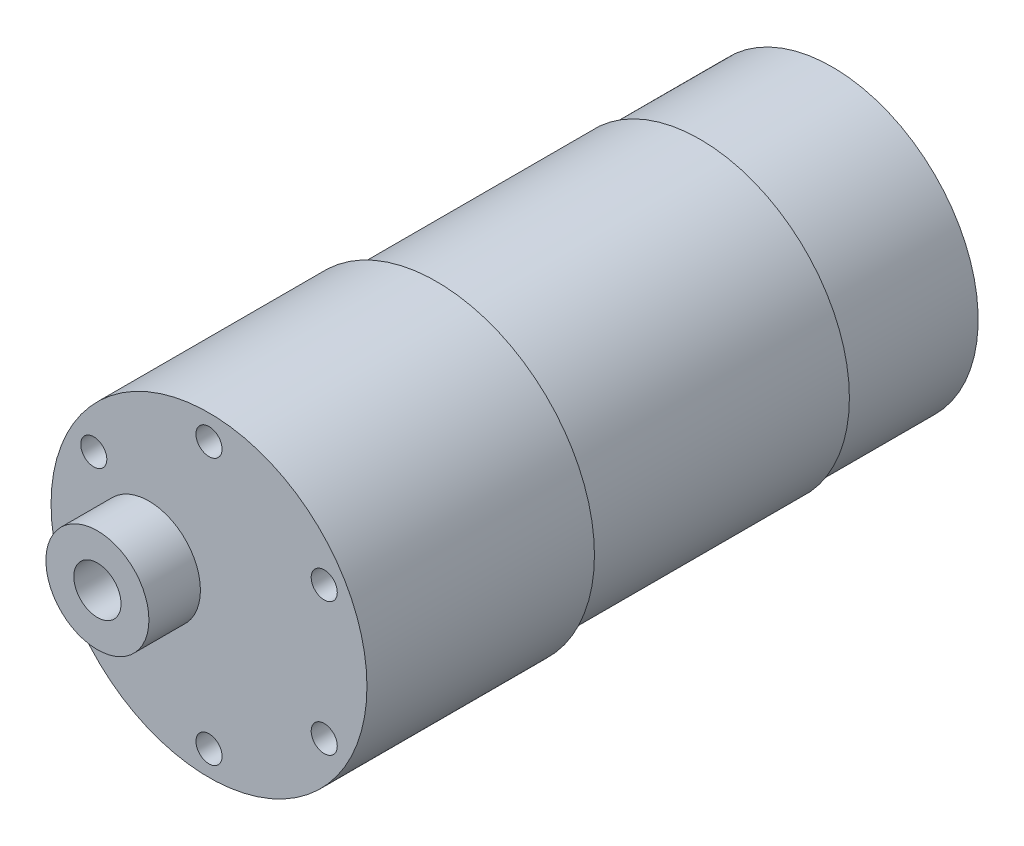
from build123d import *

# Parameters (mm, degrees)
F_01_START                                  = -57.2
S01_POLOLU_4755_BRUSHED_MOTOR_CAN_R         = 17.4
F_01_POLOLU_4755_BRUSHED_MOTOR_CAN_DEPTH    = 30.7
F_02_START                                  = -26.5
S02_37D_GEARBOX_BODY_R                      = 18.4
F_02_37D_GEARBOX_BODY_DEPTH                 = 26.5
F_03_START                                  = -3
S03_MANUFACTURER_SIX_M3_FACE_THREADS_R      = 1.52
F_03_MANUFACTURER_SIX_M3_FACE_THREADS_DEPTH = 3.2
S04_FRONT_LOCATING_BOSS_R                   = 6
F_04_FRONT_LOCATING_BOSS_DEPTH              = 6
F_05_START                                  = -72.6
S05_QUADRATURE_ENCODER_REAR_CAP_15_4_R      = 17
F_05_QUADRATURE_ENCODER_REAR_CAP_15_4_DEPTH = 15.4
F_06_START                                  = 1.6
S06_SHAFT_JOURNAL_AT_GEARBOX_OUTPUT_R       = 2.75
F_06_SHAFT_JOURNAL_AT_GEARBOX_OUTPUT_DEPTH  = 4.5


with BuildPart() as part:
    # S01 - Pololu 4755 brushed motor can → 01 - Pololu 4755 brushed motor can (new body)
    with BuildSketch(Plane.XY.offset(F_01_START)):
        with Locations((7, 0)):
            Circle(S01_POLOLU_4755_BRUSHED_MOTOR_CAN_R)
    extrude(amount=F_01_POLOLU_4755_BRUSHED_MOTOR_CAN_DEPTH)

    # S02 - 37D gearbox body → 02 - 37D gearbox body (add)
    with BuildSketch(Plane.XY.offset(F_02_START)):
        with Locations((7, 0)):
            Circle(S02_37D_GEARBOX_BODY_R)
    extrude(amount=F_02_37D_GEARBOX_BODY_DEPTH)

    # S03 - Manufacturer six M3 face threads → 03 - Manufacturer six M3 face threads (cut)
    with BuildSketch(Plane.XY.offset(F_03_START)):
        with Locations((20.423393759, 7.75)):
            Circle(S03_MANUFACTURER_SIX_M3_FACE_THREADS_R)
        with Locations((7, 15.5)):
            Circle(S03_MANUFACTURER_SIX_M3_FACE_THREADS_R)
        with Locations((-6.423393759, 7.75)):
            Circle(S03_MANUFACTURER_SIX_M3_FACE_THREADS_R)
        with Locations((-6.423393759, -7.75)):
            Circle(S03_MANUFACTURER_SIX_M3_FACE_THREADS_R)
        with Locations((7, -15.5)):
            Circle(S03_MANUFACTURER_SIX_M3_FACE_THREADS_R)
        with Locations((20.423393759, -7.75)):
            Circle(S03_MANUFACTURER_SIX_M3_FACE_THREADS_R)
    extrude(amount=F_03_MANUFACTURER_SIX_M3_FACE_THREADS_DEPTH, mode=Mode.SUBTRACT)

    # S04 - Front locating boss → 04 - Front locating boss (add)
    with BuildSketch(Plane.XY):
        Circle(S04_FRONT_LOCATING_BOSS_R)
    extrude(amount=F_04_FRONT_LOCATING_BOSS_DEPTH)

    # S05 - Quadrature encoder rear cap - 15.4 mm → 05 - Quadrature encoder rear cap - 15.4 mm (add)
    with BuildSketch(Plane.XY.offset(F_05_START)):
        with Locations(Location((7, 0, 0), (0, 0, 180))):
            Circle(S05_QUADRATURE_ENCODER_REAR_CAP_15_4_R)
    extrude(amount=F_05_QUADRATURE_ENCODER_REAR_CAP_15_4_DEPTH)

    # S06 - Shaft journal at gearbox output → 06 - Shaft journal at gearbox output (cut)
    with BuildSketch(Plane.XY.offset(F_06_START)):
        Circle(S06_SHAFT_JOURNAL_AT_GEARBOX_OUTPUT_R)
    extrude(amount=F_06_SHAFT_JOURNAL_AT_GEARBOX_OUTPUT_DEPTH, mode=Mode.SUBTRACT)


solid = part.part
